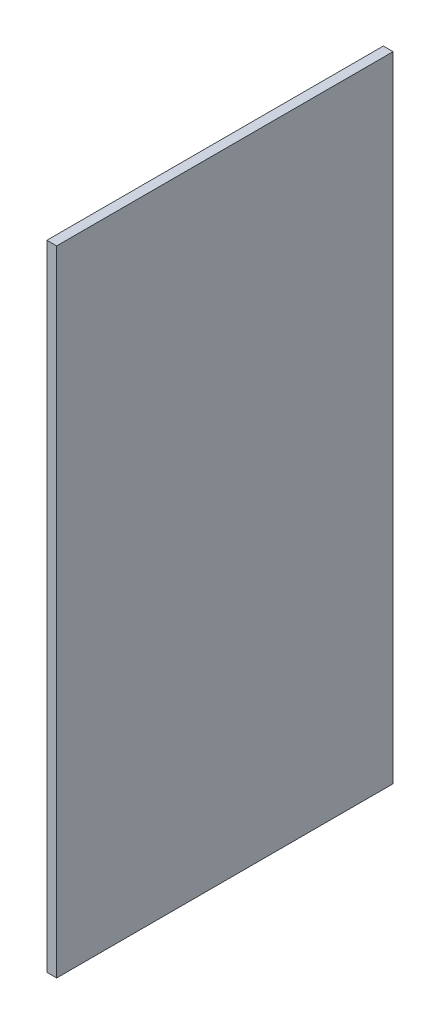
from build123d import *

# Parameters (mm, degrees)
SKETCH1_W                   = 22
SKETCH1_H                   = 1427.5
STORE_ORTA_BOLME_PU_1_DEPTH = 757.5


with BuildPart() as part:
    # Sketch1 → STORE_orta_bolme_pu_1 (new body)
    with BuildSketch(Plane.XY):
        with Locations((702, 896.25)):
            Rectangle(SKETCH1_W, SKETCH1_H)
    extrude(amount=-STORE_ORTA_BOLME_PU_1_DEPTH)


solid = part.part
